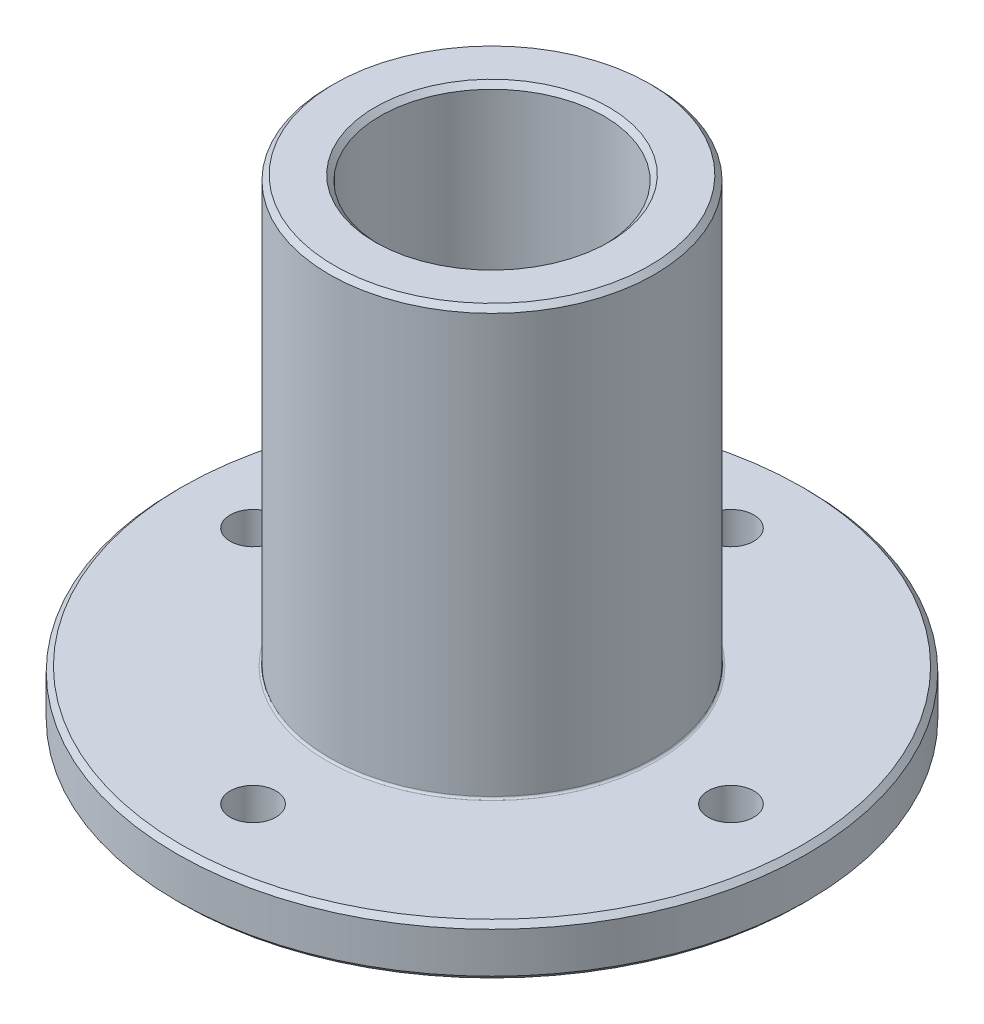
from build123d import *

# Parameters (mm, degrees)
M4_CLEARANCE_HOLE1_D     = 4.5
M4_CLEARANCE_HOLE1_DEPTH = 10
M4_CLEARANCE_HOLE1_TIP   = 1.351936393
FILLET1_R                = 0.2
CHAMFER1_SIZE            = 0.5


with BuildPart() as part:
    # Sketch1 → Revolve1 (revolve)
    with BuildSketch(Plane.XY, mode=Mode.PRIVATE) as revolve1_sk:
        Polygon((9, 0), (31, 0), (31, 5), (16, 5), (16, 46.85), (11, 46.85), (11, 8.85), (9, 8.85), align=None)
    revolve(revolve1_sk.sketch.rotate(Axis((0, 9.488188976, 0), (0, -1, 0)), 90), axis=Axis((0, 9.488188976, 0), (0, -1, 0)))

    # M4 Clearance Hole1
    with Locations(Plane(origin=(0, 5, 0), x_dir=(1, 0, 0), z_dir=(0, 1, 0))):
        with Locations((23.5, 0), (0, 23.5), (0, -23.5), (-23.5, 0)):
            Hole(M4_CLEARANCE_HOLE1_D / 2, depth=M4_CLEARANCE_HOLE1_DEPTH)
            with Locations((0, 0, -(M4_CLEARANCE_HOLE1_DEPTH + M4_CLEARANCE_HOLE1_TIP / 2))):  # 118° drill point
                Cone(0, M4_CLEARANCE_HOLE1_D / 2, M4_CLEARANCE_HOLE1_TIP, mode=Mode.SUBTRACT)

    # Sketch5 → Groove for BS 3673 P4 - B022M, Internal Circlip1 (revolve, cut)
    with BuildSketch(Plane(origin=(0, 9.488188976, 0), x_dir=(0, 0, 1), z_dir=(-1, 0, 0))):
        with BuildLine():
            Line((11.39, 5.361811024), (9.9, 5.361811024))
            Line((9.9, 5.361811024), (9.9, 6.461811024))
            Line((9.9, 6.461811024), (11.39, 6.461811024))
            ThreePointArc((11.39, 6.461811024), (11.467781746, 6.42959277), (11.5, 6.351811024))
            Line((11.5, 6.351811024), (11.5, 5.471811024))
            ThreePointArc((11.5, 5.471811024), (11.467781746, 5.394029278), (11.39, 5.361811024))
        make_face()
    revolve(axis=Axis((0, -40.511811024, 0), (0, 1, 0)), mode=Mode.SUBTRACT)

    # Fillet1
    fillet1_edges = [part.edges().sort_by_distance(p)[0] for p in [
        (0, 8.85, -11),
        (0, 5, -16),
    ]]
    fillet(fillet1_edges, radius=FILLET1_R)

    # Chamfer1
    chamfer1_edges = [part.edges().sort_by_distance(p)[0] for p in [
        (0, 0, -9),
        (0, 8.85, -9),
        (0, 46.85, -11),
        (0, 46.85, -16),
        (0, 5, -31),
        (0, 0, -31),
    ]]
    chamfer(chamfer1_edges, length=CHAMFER1_SIZE)


solid = part.part
